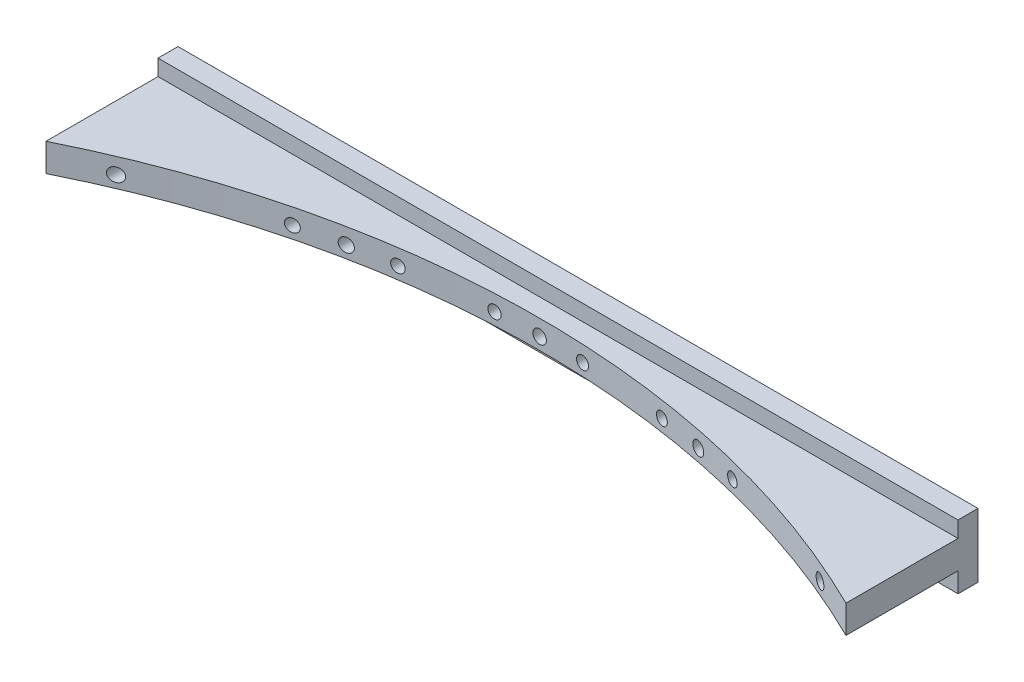
from build123d import *

# Parameters (mm, degrees)
SKETCH1_W                                        = 635
SKETCH1_H                                        = 900
BOSS_EXTRUDE1_DEPTH                              = 50.8
F_3_8_0_375_DIAMETER_HOLE1_D                     = 9.525
F_1_1_DIAMETER_HOLE1_D                           = 25.4
CIRPATTERN1_COUNT                                = 60
SKETCH9_R                                        = 715
CUT_EXTRUDE1_DEPTH                               = 1103.635769418
CBORE_FOR_3_8_SOCKET_HEAD_CAP_SCREW1_D           = 10.0838
CBORE_FOR_3_8_SOCKET_HEAD_CAP_SCREW1_CBORE_D     = 15.875
CBORE_FOR_3_8_SOCKET_HEAD_CAP_SCREW1_CBORE_DEPTH = 9.525
FILLET1_R                                        = 0.5
LPATTERN1_COUNT                                  = 6
LPATTERN1_PITCH                                  = 69.85
FILLET1_OF_LPATTERN1_R                           = 0.5
F_1_2_13_TAPPED_HOLE1_D                          = 10.71626
LPATTERN2_COUNT                                  = 5
LPATTERN2_PITCH                                  = 139.7
SKETCH19_W                                       = 635
SKETCH19_H                                       = 100
CUT_EXTRUDE2_DEPTH                               = 15.875
SKETCH20_W                                       = 635
SKETCH20_H                                       = 100
CUT_EXTRUDE3_DEPTH                               = 12.7


with BuildPart() as part:
    # Sketch1 → Boss-Extrude1 (new body)
    with BuildSketch(Plane(origin=(0, 0, 0), x_dir=(1, 0, 0), z_dir=(0, 1, 0))):
        with Locations((317.5, 450)):
            Rectangle(SKETCH1_W, SKETCH1_H)
    extrude(amount=BOSS_EXTRUDE1_DEPTH)

    # 3/8 (0.375) Diameter Hole1 (through all)
    with Locations(Plane(origin=(0, 50.8, 0), x_dir=(-1, 0, 0), z_dir=(0, 1, 0))):
        with Locations((-317.5, -855.55)):
            f_3_8_0_375_diameter_hole1 = Hole(F_3_8_0_375_DIAMETER_HOLE1_D / 2)

    # 1 (1) Diameter Hole1 (through all)
    with Locations(Plane(origin=(0, 50.8, 0), x_dir=(1, 0, 0), z_dir=(0, 1, 0))):
        with Locations((317.5, 154.55)):
            Hole(F_1_1_DIAMETER_HOLE1_D / 2)

    # CirPattern1: 3/8 (0.375) Diameter Hole1 ×60 about axis, 51 skipped
    cirpattern1_axis = Axis((317.5, 50.8, -154.55), (0, 1, 0))
    add([f_3_8_0_375_diameter_hole1.rotate(cirpattern1_axis, i * 360 / CIRPATTERN1_COUNT) for i in range(1, CIRPATTERN1_COUNT) if i not in (5, 6, 7, 8, 9, 10, 11, 12, 13, 14, 15, 16, 17, 18, 19, 20, 21, 22, 23, 24, 25, 26, 27, 28, 29, 30, 31, 32, 33, 34, 35, 36, 37, 38, 39, 40, 41, 42, 43, 44, 45, 46, 47, 48, 49, 50, 51, 52, 53, 54, 55)], mode=Mode.SUBTRACT)

    # Sketch9 → Cut-Extrude1 (cut, through all)
    with BuildSketch(Plane(origin=(0, 50.8, 0), x_dir=(1, 0, 0), z_dir=(0, 1, 0))):
        with Locations((317.5, 154.55)):
            Circle(SKETCH9_R)
    extrude(amount=-CUT_EXTRUDE1_DEPTH, mode=Mode.SUBTRACT)

    # CBORE for 3/8 Socket Head Cap Screw1 (through all)
    with Locations(Plane(origin=(0, 0, -900), x_dir=(-1, 0, 0), z_dir=(0, 0, -1))):
        with Locations((-492.125, 25.4)):
            cbore_for_3_8_socket_head_cap_screw1 = CounterBoreHole(CBORE_FOR_3_8_SOCKET_HEAD_CAP_SCREW1_D / 2, CBORE_FOR_3_8_SOCKET_HEAD_CAP_SCREW1_CBORE_D / 2, CBORE_FOR_3_8_SOCKET_HEAD_CAP_SCREW1_CBORE_DEPTH)

    # Fillet1
    fillet1_edges = [part.edges().sort_by_distance(p)[0] for p in [
        (487.0831, 25.4, -890.475),
    ]]
    fillet(fillet1_edges, radius=FILLET1_R)

    # LPattern1: CBORE for 3/8 Socket Head Cap Screw1 ×6
    with Locations(*[(-i * LPATTERN1_PITCH, 0, 0) for i in range(1, LPATTERN1_COUNT)]):
        add(cbore_for_3_8_socket_head_cap_screw1, mode=Mode.SUBTRACT)

    # Fillet1 of LPattern1
    fillet1_of_lpattern1_edges = [part.edges().sort_by_distance(p)[0] for p in [
        (417.2331, 25.4, -890.475),
        (347.3831, 25.4, -890.475),
        (277.5331, 25.4, -890.475),
        (207.6831, 25.4, -890.475),
        (137.8331, 25.4, -890.475),
    ]]
    fillet(fillet1_of_lpattern1_edges, radius=FILLET1_OF_LPATTERN1_R)

    # 1/2-13 Tapped Hole1 (through all)
    with Locations(Plane(origin=(0, 0, -900), x_dir=(-1, 0, 0), z_dir=(0, 0, -1))):
        with Locations((-596.9, 25.4)):
            f_1_2_13_tapped_hole1 = Hole(F_1_2_13_TAPPED_HOLE1_D / 2)

    # LPattern2: 1/2-13 Tapped Hole1 ×5
    with Locations(*[(-i * LPATTERN2_PITCH, 0, 0) for i in range(1, LPATTERN2_COUNT)]):
        add(f_1_2_13_tapped_hole1, mode=Mode.SUBTRACT)

    # Sketch19 → Cut-Extrude2 (cut)
    with BuildSketch(Plane.XZ):
        with Locations((317.5, -834.125)):
            Rectangle(SKETCH19_W, SKETCH19_H)
    extrude(amount=-CUT_EXTRUDE2_DEPTH, mode=Mode.SUBTRACT)

    # Sketch20 → Cut-Extrude3 (cut)
    with BuildSketch(Plane(origin=(0, 50.8, 0), x_dir=(1, 0, 0), z_dir=(0, 1, 0))):
        with Locations((317.5, 834.125)):
            Rectangle(SKETCH20_W, SKETCH20_H)
    extrude(amount=-CUT_EXTRUDE3_DEPTH, mode=Mode.SUBTRACT)


solid = part.part
